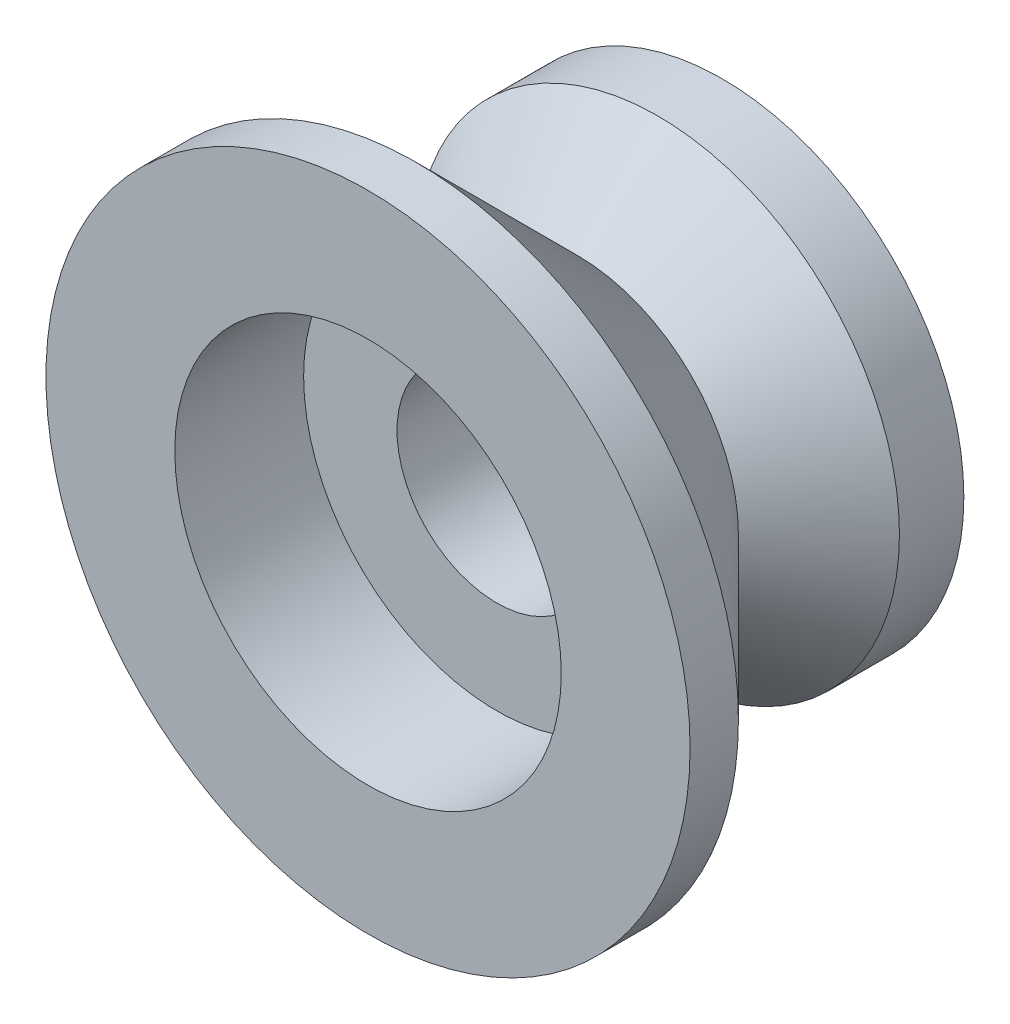
from build123d import *

# Parameters (mm, degrees)
SKETCH_2_R          = 6
CUT_EXTRUDE_1_DEPTH = 4
SKETCH_3_R          = 3.1
CUT_EXTRUDE_2_DEPTH = 16.779733838


with BuildPart() as part:
    # 草图1 → 旋转1 (revolve)
    with BuildSketch(Plane(origin=(0, 0, 0), x_dir=(1, 0, 0), z_dir=(0, 1, 0)), mode=Mode.PRIVATE) as revolve_1_sk:
        Polygon((-7.5, 9), (-5, 6.5), (-7.5, 4), (-10, 1.5), (-10, 0), (0, 0), (0, 11), (-7.5, 11), align=None)
    revolve(revolve_1_sk.sketch.rotate(Axis((0, 0, 1000), (0, 0, -1)), 180), axis=Axis((0, 0, 1000), (0, 0, -1)))

    # 草图2 → 切除-拉伸1 (cut)
    with BuildSketch(Plane.XY):
        Circle(SKETCH_2_R)
    extrude(amount=-CUT_EXTRUDE_1_DEPTH, mode=Mode.SUBTRACT)

    # 草图3 → 切除-拉伸2 (cut, through all)
    with BuildSketch(Plane.XY.offset(-4)):
        Circle(SKETCH_3_R)
    extrude(amount=-CUT_EXTRUDE_2_DEPTH, mode=Mode.SUBTRACT)


solid = part.part
